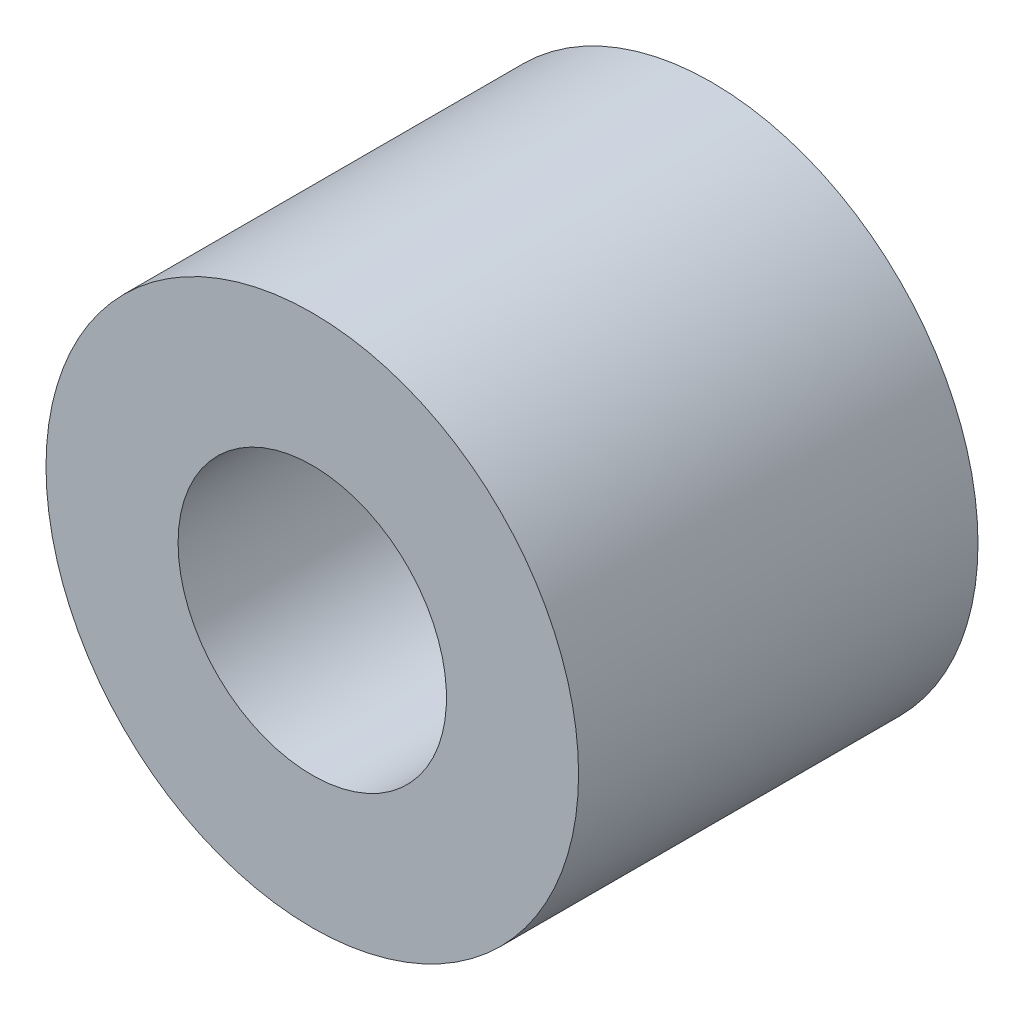
from build123d import *

# Parameters (mm, degrees)
SKETCH1_R      = 6.35
SKETCH1_R_2    = 3.2004
EXTRUDE1_DEPTH = 4.7625


with BuildPart() as part:
    # Sketch1 → Extrude1 (new, symmetric)
    with BuildSketch(Plane.XY):
        with Locations(Location((0, 0, 0), (0, 0, 180))):
            Circle(SKETCH1_R)
        with Locations(Location((0, 0, 0), (0, 0, 180))):
            Circle(SKETCH1_R_2, mode=Mode.SUBTRACT)
    extrude(amount=EXTRUDE1_DEPTH, both=True)


solid = part.part
